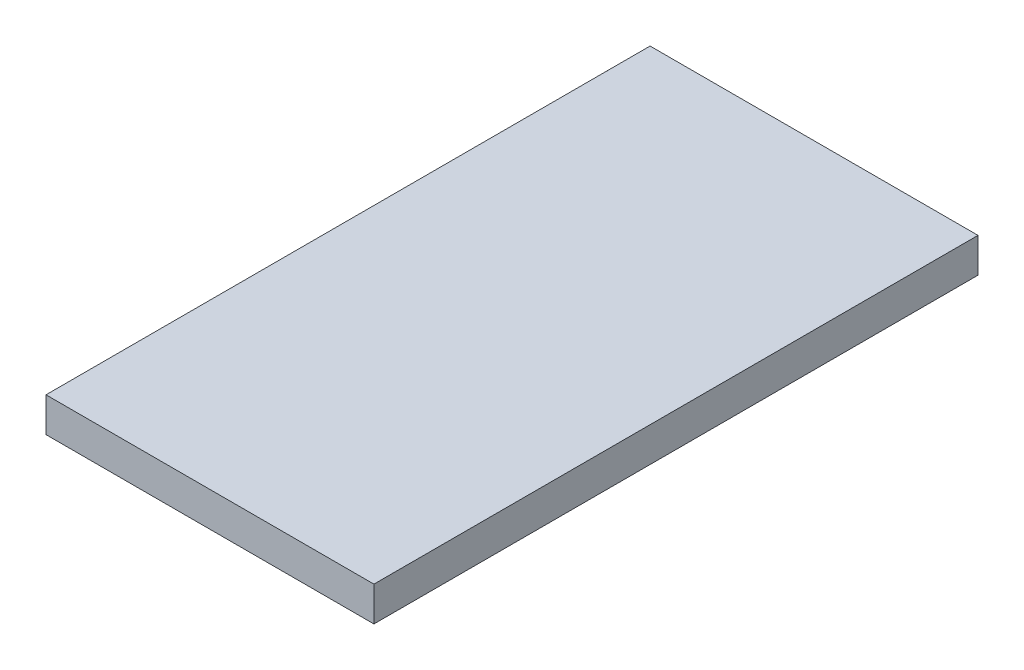
from build123d import *

# Parameters (mm, degrees)
CROQUIS1_W              = 19
CROQUIS1_H              = 35
SALIENTE_EXTRUIR4_DEPTH = 2


with BuildPart() as part:
    # Croquis1 → Saliente-Extruir4 (new body)
    with BuildSketch(Plane(origin=(0, 0, 0), x_dir=(1, 0, 0), z_dir=(0, 1, 0))):
        Rectangle(CROQUIS1_W, CROQUIS1_H)
    extrude(amount=SALIENTE_EXTRUIR4_DEPTH)


solid = part.part
